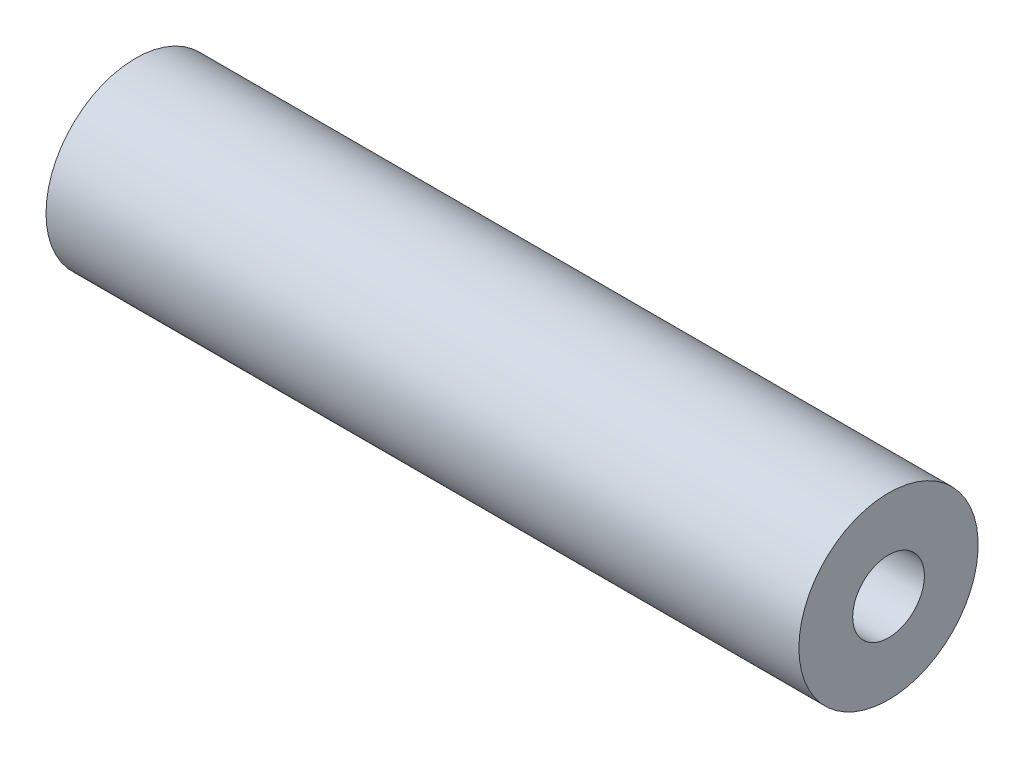
from build123d import *

# Parameters (mm, degrees)
SKETCH_1_R      = 5
SKETCH_1_R_2    = 2
EXTRUDE_1_DEPTH = 21


with BuildPart() as part:
    # 草图1 → 凸台-拉伸1 (new, symmetric)
    with BuildSketch(Plane(origin=(0, 0, 0), x_dir=(0, 0, -1), z_dir=(1, 0, 0))):
        with Locations(Location((0, 0, 0), (0, 0, 180))):
            Circle(SKETCH_1_R)
        with Locations(Location((0, 0, 0), (0, 0, 180))):
            Circle(SKETCH_1_R_2, mode=Mode.SUBTRACT)
    extrude(amount=EXTRUDE_1_DEPTH, both=True)


solid = part.part
